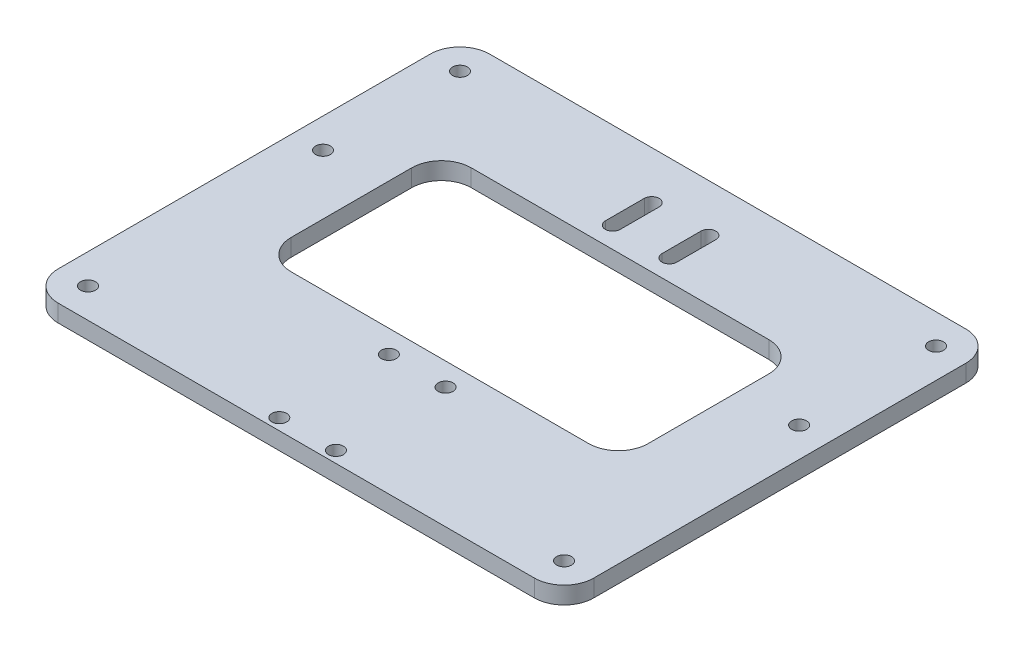
from build123d import *

# Parameters (mm, degrees)
SKETCH1_W           = 180
SKETCH1_H           = 145
BOSS_EXTRUDE1_DEPTH = 2.9
CUT_EXTRUDE1_DEPTH  = 124.929980231
SKETCH3_R           = 2.5
CUT_EXTRUDE2_DEPTH  = 124.929980231
SKETCH4_R           = 2.5
CUT_EXTRUDE3_DEPTH  = 124.929980231
FILLET1_R           = 10


with BuildPart() as part:
    # Sketch1 → Boss-Extrude1 (new, symmetric)
    with BuildSketch(Plane(origin=(0, 0, 0), x_dir=(1, 0, 0), z_dir=(0, 1, 0))):
        with Locations((0, -12.5)):
            Rectangle(SKETCH1_W, SKETCH1_H)
    extrude(amount=BOSS_EXTRUDE1_DEPTH, both=True)

    # Sketch2 → Cut-Extrude1 (cut, through all)
    with BuildSketch(Plane(origin=(0, 2.9, 0), x_dir=(1, 0, 0), z_dir=(0, 1, 0))):
        Polygon((-60, 23.8), (60, 23.8), (60, -23.8), (60, -36.74), (-60, -36.74), (-60, -23.8), align=None)
    extrude(amount=-CUT_EXTRUDE1_DEPTH, mode=Mode.SUBTRACT)

    # Sketch3 → Cut-Extrude2 (cut, through all)
    with BuildSketch(Plane(origin=(0, 2.9, 0), x_dir=(1, 0, 0), z_dir=(0, 1, 0))):
        with Locations(Location((-9.525, -44.36, 0), (0, 0, 270))):
            Circle(SKETCH3_R)
        with Locations(Location((9.525, -44.36, 0), (0, 0, 270))):
            Circle(SKETCH3_R)
        with Locations(Location((-9.525, -81.19, 0), (0, 0, 270))):
            Circle(SKETCH3_R)
        with Locations(Location((9.525, -81.19, 0), (0, 0, 270))):
            Circle(SKETCH3_R)
        with BuildLine():
            Line((-12.025, 30.889667183), (-12.025, 43.982098817))
            ThreePointArc((-12.025, 43.982098817), (-9.525, 46.482098817), (-7.025, 43.982098817))
            Line((-7.025, 43.982098817), (-7.025, 30.889667183))
            ThreePointArc((-7.025, 30.889667183), (-9.525, 28.389667183), (-12.025, 30.889667183))
        make_face()
        with BuildLine():
            Line((7.025, 30.889667183), (7.025, 43.982098817))
            ThreePointArc((7.025, 43.982098817), (9.525, 46.482098817), (12.025, 43.982098817))
            Line((12.025, 43.982098817), (12.025, 30.889667183))
            ThreePointArc((12.025, 30.889667183), (9.525, 28.389667183), (7.025, 30.889667183))
        make_face()
    extrude(amount=-CUT_EXTRUDE2_DEPTH, mode=Mode.SUBTRACT)

    # Sketch4 → Cut-Extrude3 (cut, through all)
    with BuildSketch(Plane(origin=(0, 2.9, 0), x_dir=(1, 0, 0), z_dir=(0, 1, 0))):
        with Locations(Location((-80, 50, 0), (0, 0, 270))):
            Circle(SKETCH4_R)
        with Locations(Location((-80, 3.99826174, 0), (0, 0, 270))):
            Circle(SKETCH4_R)
        with Locations(Location((-80, -75, 0), (0, 0, 270))):
            Circle(SKETCH4_R)
        with Locations(Location((80, -75, 0), (0, 0, 270))):
            Circle(SKETCH4_R)
        with Locations(Location((80, 3.99826174, 0), (0, 0, 270))):
            Circle(SKETCH4_R)
        with Locations(Location((80, 50, 0), (0, 0, 270))):
            Circle(SKETCH4_R)
    extrude(amount=-CUT_EXTRUDE3_DEPTH, mode=Mode.SUBTRACT)

    # Fillet1
    fillet1_edges = [part.edges().sort_by_distance(p)[0] for p in [
        (-60, 0, -23.8),
        (60, 0, -23.8),
        (60, 0, 36.74),
        (-60, 0, 36.74),
        (90, 0, 85),
        (-90, 0, 85),
        (-90, 0, -60),
        (90, 0, -60),
    ]]
    fillet(fillet1_edges, radius=FILLET1_R)


solid = part.part
